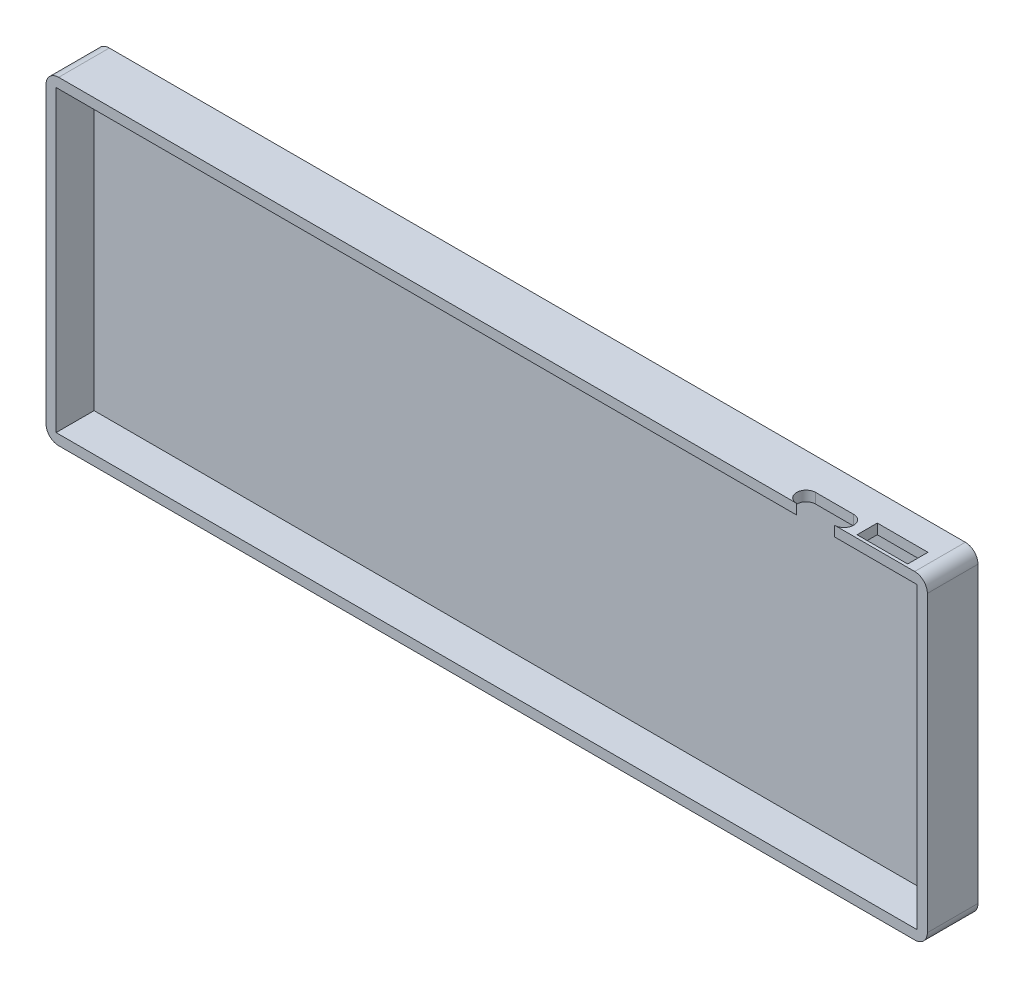
from build123d import *

# Parameters (mm, degrees)
SKETCH1_W           = 348
SKETCH1_H           = 126
BOSS_EXTRUDE1_DEPTH = 20
SKETCH2_W           = 340
SKETCH2_H           = 118
CUT_EXTRUDE1_DEPTH  = 15
CUT_EXTRUDE2_REACH  = 217.759
CUT_EXTRUDE3_REACH  = 217.759
SKETCH5_W           = 20
SKETCH5_H           = 8
FILLET1_R           = 5


with BuildPart() as part:
    # Sketch1 → Boss-Extrude1 (new body)
    with BuildSketch(Plane.XY):
        Rectangle(SKETCH1_W, SKETCH1_H)
    extrude(amount=BOSS_EXTRUDE1_DEPTH)

    # Sketch2 → Cut-Extrude1 (cut)
    with BuildSketch(Plane.XY.offset(20)):
        Rectangle(SKETCH2_W, SKETCH2_H)
    extrude(amount=-CUT_EXTRUDE1_DEPTH, mode=Mode.SUBTRACT)

    # Sketch4 → Cut-Extrude2 (cut, up to next)
    with BuildSketch(Plane(origin=(0, 63, 0), x_dir=(1, 0, 0), z_dir=(0, 1, 0)), mode=Mode.PRIVATE) as cut_extrude2_sk1:
        with BuildLine():
            Line((122.39, -12.5), (137.39, -12.5))
            ThreePointArc((137.39, -12.5), (141.14, -16.25), (137.39, -20))
            Line((137.39, -20), (122.39, -20))
            ThreePointArc((122.39, -20), (118.64, -16.25), (122.39, -12.5))
        make_face()
    cut_extrude2_tool1 = extrude(cut_extrude2_sk1.sketch, amount=-CUT_EXTRUDE2_REACH, mode=Mode.PRIVATE) & part.part
    add(cut_extrude2_tool1.solids().sort_by_distance((129.89, 63, 16.25))[0], mode=Mode.SUBTRACT)

    # Sketch5 → Cut-Extrude3 (cut, up to next)
    with BuildSketch(Plane(origin=(0, 63, 0), x_dir=(1, 0, 0), z_dir=(0, 1, 0)), mode=Mode.PRIVATE) as cut_extrude3_sk1:
        with Locations((155.05, -14.81)):
            Rectangle(SKETCH5_W, SKETCH5_H)
    cut_extrude3_tool1 = extrude(cut_extrude3_sk1.sketch, amount=-CUT_EXTRUDE3_REACH, mode=Mode.PRIVATE) & part.part
    add(cut_extrude3_tool1.solids().sort_by_distance((155.05, 63, 14.81))[0], mode=Mode.SUBTRACT)

    # Fillet1
    fillet1_edges = [part.edges().sort_by_distance(p)[0] for p in [
        (-174, 63, 10),
        (174, 63, 10),
        (174, -63, 10),
        (-174, -63, 10),
    ]]
    fillet(fillet1_edges, radius=FILLET1_R)


solid = part.part
